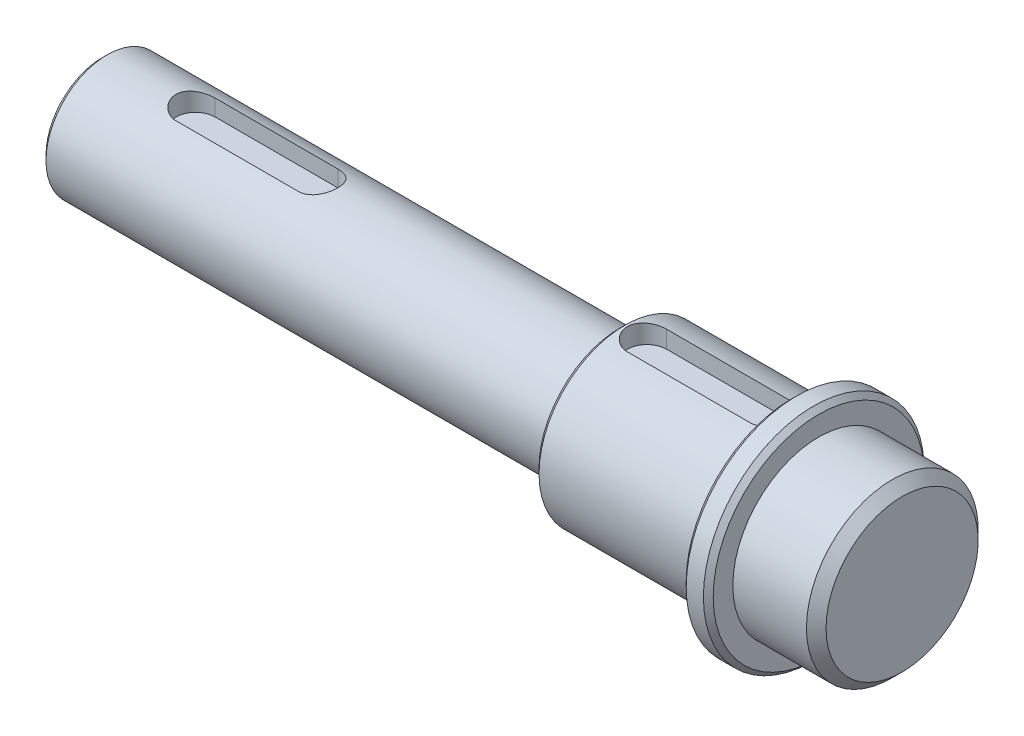
from build123d import *

# Parameters (mm, degrees)
CUT_EXTRUDE1_DEPTH  = 4
SKETCH3_R           = 12.483239851
BOSS_EXTRUDE1_DEPTH = 63
CUT_EXTRUDE2_DEPTH  = 4
CHAMFER1_SIZE       = 1


with BuildPart() as part:
    # Sketch1 → Revolve1 (revolve)
    with BuildSketch(Plane.XY, mode=Mode.PRIVATE) as revolve1_sk:
        Polygon((-63.043142844, 0), (-63.043142844, 12.483239851), (-20.551205143, 12.483239851), (-20.544749915, 16.500001291), (-19.543142844, 17.5), (14.456857156, 17.5), (14.456857156, 21.5), (15.456857156, 22.5), (18.956857156, 22.5), (19.956857156, 21.5), (19.956857156, 17.5), (34.956857156, 17.5), (36.956857156, 15.5), (36.956857156, 0), align=None)
    revolve(revolve1_sk.sketch.rotate(Axis((-79.289099526, 0, 0), (1, 0, 0)), 90), axis=Axis((-79.289099526, 0, 0), (1, 0, 0)))

    # Sketch2 → Cut-Extrude1 (cut)
    with BuildSketch(Plane(origin=(0, 17.5, 0), x_dir=(1, 0, 0), z_dir=(0, 1, 0))):
        with BuildLine():
            Line((-15.033175355, 4), (9.966824645, 4))
            ThreePointArc((9.966824645, 4), (13.966824645, 0), (9.966824645, -4))
            Line((9.966824645, -4), (-15.033175355, -4))
            ThreePointArc((-15.033175355, -4), (-19.033175355, 0), (-15.033175355, 4))
        make_face()
    extrude(amount=-CUT_EXTRUDE1_DEPTH, mode=Mode.SUBTRACT)

    # Sketch3 → Boss-Extrude1 (add)
    with BuildSketch(Plane.ZY.offset(63.043142844)):
        Circle(SKETCH3_R)
    extrude(amount=BOSS_EXTRUDE1_DEPTH)

    # Sketch4 → Cut-Extrude2 (cut)
    with BuildSketch(Plane(origin=(0, 12.483239851, 0), x_dir=(1, 0, 0), z_dir=(0, 1, 0))):
        with BuildLine():
            Line((-107.043142844, 4), (-82.043142844, 4))
            ThreePointArc((-82.043142844, 4), (-78.043142844, 0), (-82.043142844, -4))
            Line((-82.043142844, -4), (-107.043142844, -4))
            ThreePointArc((-107.043142844, -4), (-111.043142844, 0), (-107.043142844, 4))
        make_face()
    extrude(amount=-CUT_EXTRUDE2_DEPTH, mode=Mode.SUBTRACT)

    # Chamfer1
    chamfer1_edges = [part.edges().sort_by_distance(p)[0] for p in [
        (-126.043142844, 0, -12.483239851),
    ]]
    chamfer(chamfer1_edges, length=CHAMFER1_SIZE)


solid = part.part
